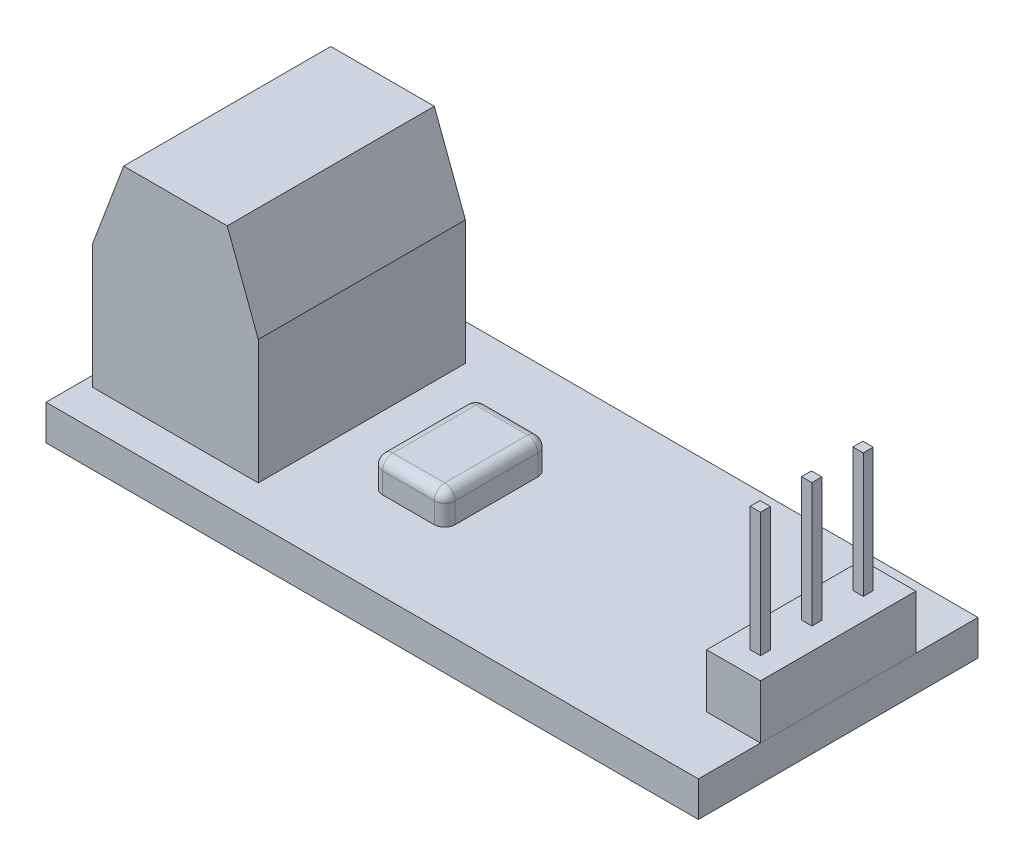
from build123d import *

# Parameters (mm, degrees)
CROQUIS1_W                = 31.5
CROQUIS1_H                = 13.5
SALIENTE_EXTRUIR1_DEPTH   = 1.7
CROQUIS2_W                = 2.6
CROQUIS2_H                = 7.5
SALIENTE_EXTRUIR2_DEPTH   = 2.6
CROQUIS3_W                = 0.5
CROQUIS3_H                = 0.480769231
SALIENTE_EXTRUIR3_DEPTH   = 6
CROQUIS3_H_2              = 0.48076923
SALIENTE_EXTRUIR3_2_DEPTH = 6
SALIENTE_EXTRUIR3_3_DEPTH = 6
CROQUIS4_W                = 8
CROQUIS4_H                = 10
SALIENTE_EXTRUIR4_DEPTH   = 10
CORTAR_EXTRUIR1_DEPTH     = 23.869521202
CROQUIS6_W                = 3.5
CROQUIS6_H                = 5
SALIENTE_EXTRUIR5_DEPTH   = 1.5
REDONDEO1_R               = 0.5


with BuildPart() as part:
    # Croquis1 → Saliente-Extruir1 (new body)
    with BuildSketch(Plane(origin=(0, 0, 0), x_dir=(1, 0, 0), z_dir=(0, 1, 0))):
        Rectangle(CROQUIS1_W, CROQUIS1_H)
    extrude(amount=SALIENTE_EXTRUIR1_DEPTH)


with BuildPart() as body_2:
    # Croquis2 → Saliente-Extruir2 (new body)
    with BuildSketch(Plane(origin=(0, 1.7, 0), x_dir=(1, 0, 0), z_dir=(0, 1, 0))):
        with Locations((14.45, 0)):
            Rectangle(CROQUIS2_W, CROQUIS2_H)
    extrude(amount=SALIENTE_EXTRUIR2_DEPTH)


with BuildPart() as body_3:
    # Croquis3 → Saliente-Extruir3 (new body)
    with BuildSketch(Plane(origin=(0, 4.3, 0), x_dir=(1, 0, 0), z_dir=(0, 1, 0))):
        with Locations((14.45, 0.01923077)):
            Rectangle(CROQUIS3_W, CROQUIS3_H)
    extrude(amount=SALIENTE_EXTRUIR3_DEPTH)


with BuildPart() as body_4:
    # Croquis3 → Saliente-Extruir3 2 (new body)
    with BuildSketch(Plane(origin=(0, 4.3, 0), x_dir=(1, 0, 0), z_dir=(0, 1, 0))):
        with Locations((14.45, 2.5)):
            Rectangle(CROQUIS3_W, CROQUIS3_H_2)
    extrude(amount=SALIENTE_EXTRUIR3_2_DEPTH)


with BuildPart() as body_5:
    # Croquis3 → Saliente-Extruir3 3 (new body)
    with BuildSketch(Plane(origin=(0, 4.3, 0), x_dir=(1, 0, 0), z_dir=(0, 1, 0))):
        with Locations((14.45, -2.461538461)):
            Rectangle(CROQUIS3_W, CROQUIS3_H)
    extrude(amount=SALIENTE_EXTRUIR3_3_DEPTH)


with BuildPart() as body_6:
    # Croquis4 → Saliente-Extruir4 (new body)
    with BuildSketch(Plane(origin=(0, 1.7, 0), x_dir=(1, 0, 0), z_dir=(0, 1, 0))):
        with Locations((-11.25, 0)):
            Rectangle(CROQUIS4_W, CROQUIS4_H)
    extrude(amount=SALIENTE_EXTRUIR4_DEPTH)

    # Croquis5 → Cortar-Extruir1 (cut, through all)
    with BuildSketch(Plane.XY.offset(5)):
        Polygon((-8.75, 11.7), (-7.25, 7.7), (-7.25, 11.7), align=None)
        Polygon((-15.25, 7.7), (-15.25, 11.7), (-13.75, 11.7), align=None)
    extrude(amount=-CORTAR_EXTRUIR1_DEPTH, mode=Mode.SUBTRACT)


with BuildPart() as body_7:
    # Croquis6 → Saliente-Extruir5 (new body)
    with BuildSketch(Plane(origin=(0, 1.7, 0), x_dir=(1, 0, 0), z_dir=(0, 1, 0))):
        with Locations((-2.5, 0)):
            Rectangle(CROQUIS6_W, CROQUIS6_H)
    extrude(amount=SALIENTE_EXTRUIR5_DEPTH)

    # Redondeo1
    redondeo1_edges = [body_7.edges().sort_by_distance(p)[0] for p in [
        (-0.75, 3.2, 0),
        (-2.5, 3.2, -2.5),
        (-4.25, 3.2, 0),
        (-4.25, 2.45, -2.5),
        (-0.75, 2.45, -2.5),
        (-0.75, 2.45, 2.5),
        (-4.25, 2.45, 2.5),
        (-2.5, 3.2, 2.5),
    ]]
    fillet(redondeo1_edges, radius=REDONDEO1_R)


solid = Compound([part.part, body_2.part, body_3.part, body_4.part, body_5.part, body_6.part, body_7.part])
